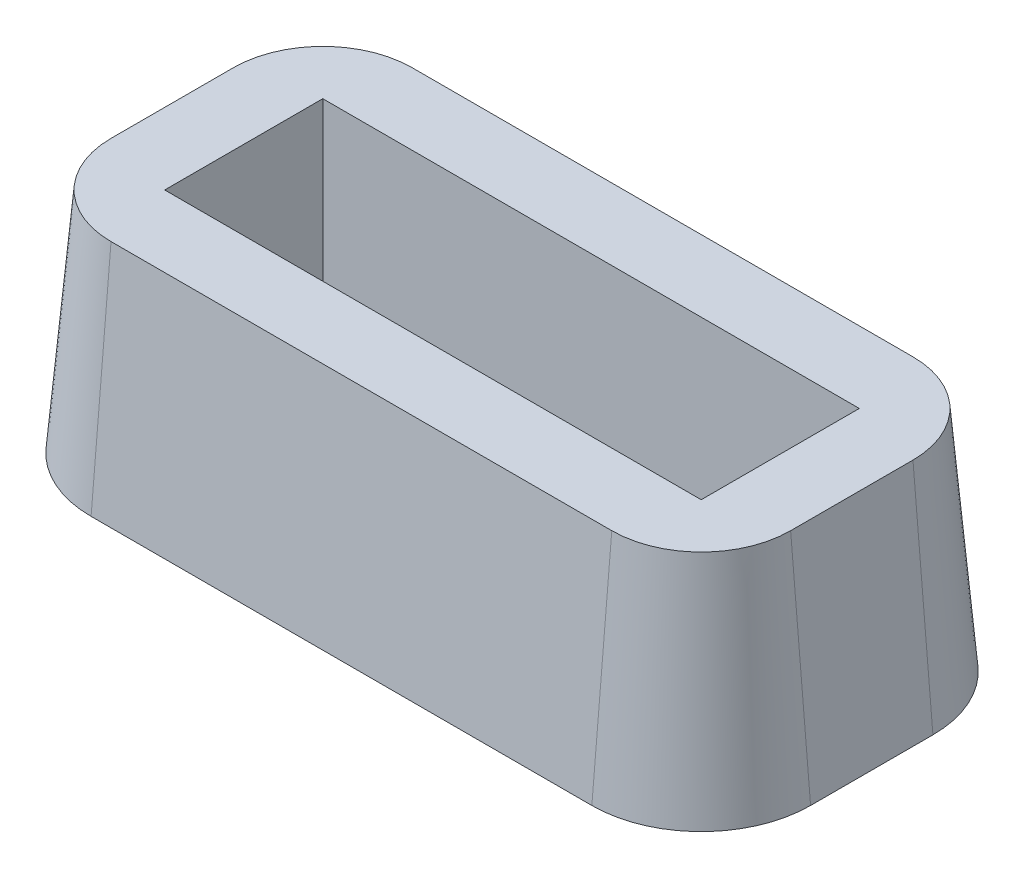
from build123d import *

# Parameters (mm, degrees)
SKETCH1_W           = 30
SKETCH1_H           = 8.84
BOSS_EXTRUDE1_DEPTH = 12.75
DRAFT1_ANGLE        = 5


with BuildPart() as part:
    # Sketch1 → Boss-Extrude1 (new body)
    with BuildSketch(Plane(origin=(0, 0, 0), x_dir=(1, 0, 0), z_dir=(0, 1, 0))):
        with BuildLine():
            Line((14, -8.42), (-14, -8.42))
            ThreePointArc((-14, -8.42), (-17.535533906, -6.955533906), (-19, -3.42))
            Line((-19, -3.42), (-19, 3.42))
            ThreePointArc((-19, 3.42), (-17.535533906, 6.955533906), (-14, 8.42))
            Line((-14, 8.42), (14, 8.42))
            ThreePointArc((14, 8.42), (17.535533906, 6.955533906), (19, 3.42))
            Line((19, 3.42), (19, -3.42))
            ThreePointArc((19, -3.42), (17.535533906, -6.955533906), (14, -8.42))
        make_face()
        Rectangle(SKETCH1_W, SKETCH1_H, mode=Mode.SUBTRACT)
    extrude(amount=BOSS_EXTRUDE1_DEPTH)

    # Draft1
    draft1_faces = [part.faces().sort_by_distance(p)[0] for p in [
        (-17.535533906, 6.375, 6.955533906),
        (-19, 6.375, 0),
        (-17.535533906, 6.375, -6.955533906),
        (0, 6.375, -8.42),
        (17.535533906, 6.375, -6.955533906),
        (19, 6.375, 0),
        (17.535533906, 6.375, 6.955533906),
        (0, 6.375, 8.42),
    ]]
    draft(draft1_faces, Plane(origin=(-14, 12.75, 3.42), x_dir=(0, 0, 1), z_dir=(0, 1, 0)), DRAFT1_ANGLE)


solid = part.part
